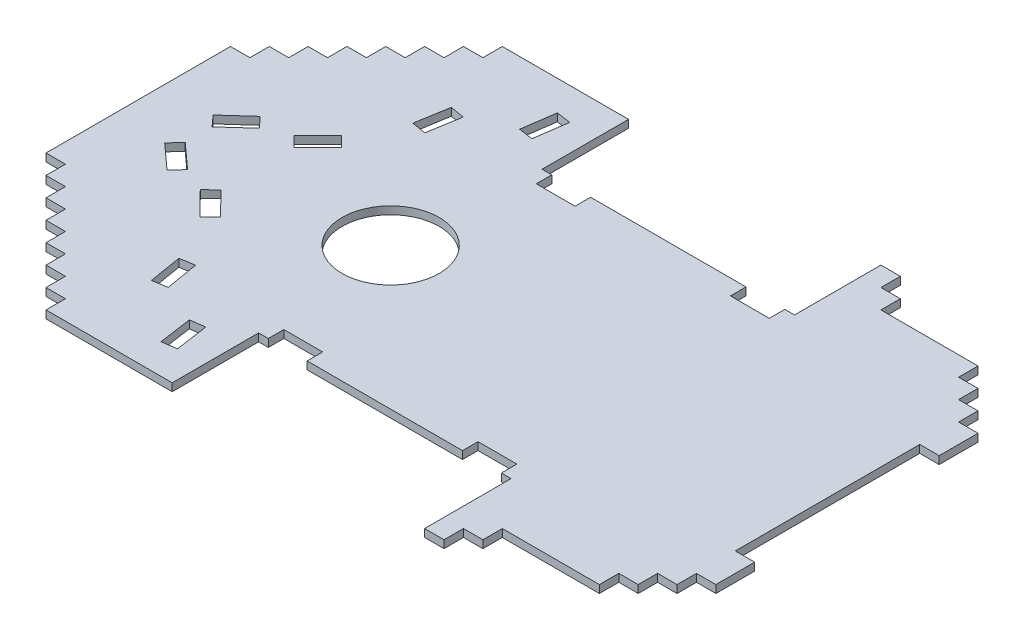
from build123d import *

# Parameters (mm, degrees)
SKETCH_5_R      = 5
EXTRUDE_1_DEPTH = 0.8


with BuildPart() as part:
    # 스케치5 → 보스-돌출1 (new body)
    with BuildSketch(Plane(origin=(0, 0, 0), x_dir=(1, 0, 0), z_dir=(0, 1, 0))):
        Polygon((-13, -23.5), (-13, -14.6), (-12, -14.6), (-12, -13), (-8, -13), (-8, -14.6), (8, -14.6), (8, -13), (12, -13), (12, -14.6), (13, -14.6), (13, -23.5), (15, -23.5), (15, -21.5), (17, -21.5), (17, -19.5), (27, -19.5), (27, -17.5), (29, -17.5), (29, -15.5), (31, -15.5), (31, -13.5), (33, -13.5), (33, -9.5), (31, -9.5), (31, 9.5), (33, 9.5), (33, 13.5), (31, 13.5), (31, 15.5), (29, 15.5), (29, 17.5), (27, 17.5), (27, 19.5), (17, 19.5), (17, 21.5), (15, 21.5), (15, 23.5), (13, 23.5), (13, 14.6), (12, 14.6), (12, 13), (8, 13), (8, 14.6), (-8, 14.6), (-8, 13), (-12, 13), (-12, 14.6), (-13, 14.6), (-13, 23.5), (-26, 23.5), (-26, 21.5), (-28, 21.5), (-28, 19.5), (-30, 19.5), (-30, 17.5), (-32, 17.5), (-32, 15.5), (-34, 15.5), (-34, 13.5), (-36, 13.5), (-36, 11.5), (-38, 11.5), (-38, 9.5), (-40, 9.5), (-40, -9.5), (-38, -9.5), (-38, -11.5), (-36, -11.5), (-36, -13.5), (-34, -13.5), (-34, -15.5), (-32, -15.5), (-32, -17.5), (-30, -17.5), (-30, -19.5), (-28, -19.5), (-28, -21.5), (-26, -21.5), (-26, -23.5), align=None)
        with Locations((-14, 0)):
            Circle(SKETCH_5_R, mode=Mode.SUBTRACT)
        Polygon((-17.728524487, -17.009831185), (-17.241222705, -20.415141299), (-15.756349109, -20.202655057), (-16.243650891, -16.797344943), align=None, mode=Mode.SUBTRACT)
        Polygon((-23.763263852, -12.051103665), (-23.19560882, -15.443944328), (-21.716172484, -15.196420332), (-22.283827516, -11.803579668), align=None, mode=Mode.SUBTRACT)
        Polygon((-28.776184385, -4.834516937), (-26.354359033, -7.277540056), (-25.289087324, -6.22151156), (-27.710912676, -3.77848844), align=None, mode=Mode.SUBTRACT)
        Polygon((-32.230719309, -4.802671603), (-34.781815362, -2.494965181), (-33.775548026, -1.382568646), (-31.224451974, -3.690275068), align=None, mode=Mode.SUBTRACT)
        Polygon((-17.241222705, 20.415141299), (-15.756349109, 20.202655057), (-16.243650891, 16.797344943), (-17.728524487, 17.009831185), align=None, mode=Mode.SUBTRACT)
        Polygon((-23.19560882, 15.443944328), (-21.716172484, 15.196420332), (-22.283827516, 11.803579668), (-23.763263852, 12.051103665), align=None, mode=Mode.SUBTRACT)
        Polygon((-26.354359033, 7.277540056), (-25.289087324, 6.22151156), (-27.710912676, 3.77848844), (-28.776184385, 4.834516937), align=None, mode=Mode.SUBTRACT)
        Polygon((-34.781815362, 2.494965181), (-33.775548026, 1.382568646), (-31.224451974, 3.690275068), (-32.230719309, 4.802671603), align=None, mode=Mode.SUBTRACT)
    extrude(amount=EXTRUDE_1_DEPTH)


solid = part.part
